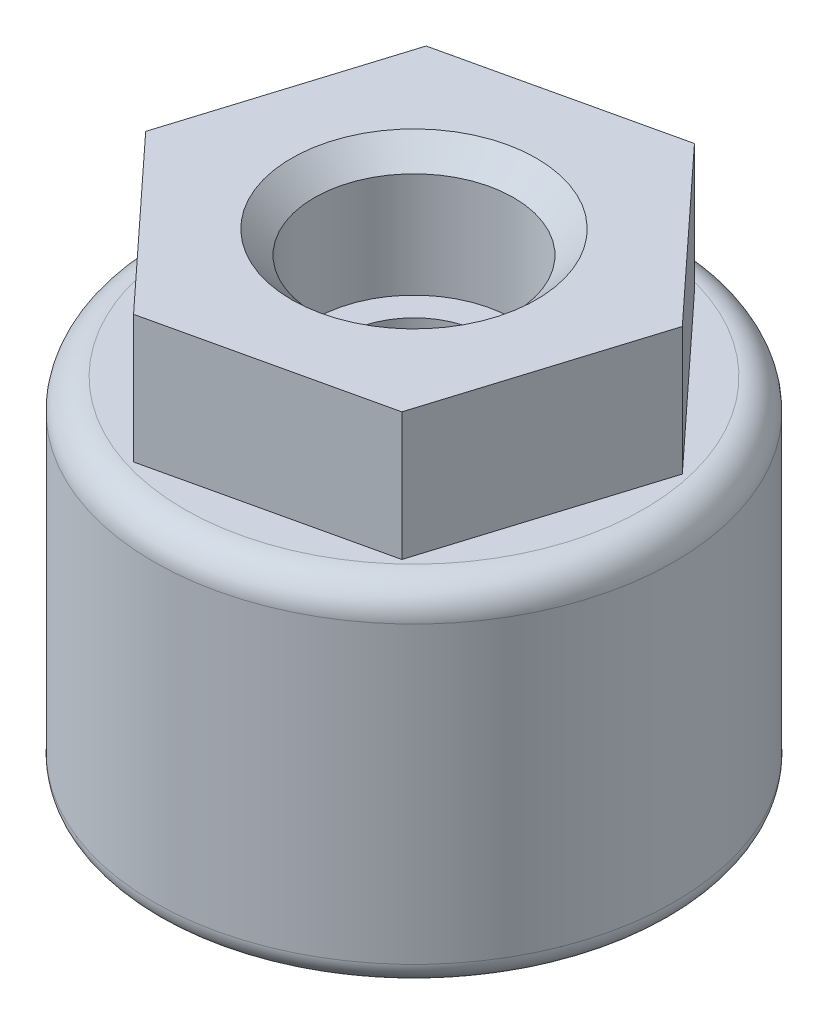
from build123d import *

# Parameters (mm, degrees)
IZIM1_R                     = 14.285
Y_KSEKLIK_EKSTR_ZYON1_DEPTH = 19.1
RADYUS1_R                   = 1.67
RADYUS2_R                   = 1.25
Y_KSEKLIK_EKSTR_ZYON3_DEPTH = 7.02
KES_EKSTR_ZYON1_DEPTH       = 2
KES_EKSTR_ZYON1_DEPTH_BACK  = 29.02
IZIM4_R                     = 3.95
IZIM5_R                     = 5.475
KES_EKSTR_ZYON2_DEPTH       = 7.02
PAH1_SIZE                   = 1.25


with BuildPart() as part:
    # Çizim1 → Yükseklik-Ekstrüzyon1 (new body)
    with BuildSketch(Plane(origin=(0, 0, 0), x_dir=(1, 0, 0), z_dir=(0, 1, 0))):
        with Locations(Location((0, 0, 0), (0, 0, 270))):
            Circle(IZIM1_R)
    extrude(amount=Y_KSEKLIK_EKSTR_ZYON1_DEPTH)

    # Radyus1
    radyus1_edges = [part.edges().sort_by_distance(p)[0] for p in [
        (0, 19.1, -14.285),
    ]]
    fillet(radyus1_edges, radius=RADYUS1_R)

    # Radyus2
    radyus2_edges = [part.edges().sort_by_distance(p)[0] for p in [
        (0, 0, -14.285),
    ]]
    fillet(radyus2_edges, radius=RADYUS2_R)

    # Çizim2 → Yükseklik-Ekstrüzyon3 (add)
    with BuildSketch(Plane(origin=(0, 19.1, 0), x_dir=(1, 0, 0), z_dir=(0, 1, 0))):
        Polygon((8.364308265, -9.030641206), (12.002918829, 2.728382839), (3.638610564, 11.759024045), (-8.364308265, 9.030641206), (-12.002918829, -2.728382839), (-3.638610564, -11.759024045), align=None)
    extrude(amount=Y_KSEKLIK_EKSTR_ZYON3_DEPTH)

    # Çizim4 → Kes-Ekstrüzyon1 (cut, two sides: drawn at the far end of the back side and taken through both)
    with BuildSketch(Plane(origin=(0, 26.12, 0), x_dir=(1, 0, 0), z_dir=(0, 1, 0)).offset(-KES_EKSTR_ZYON1_DEPTH_BACK)):
        with Locations(Location((0, 0, 0), (0, 0, 270))):
            Circle(IZIM4_R)
    extrude(amount=KES_EKSTR_ZYON1_DEPTH + KES_EKSTR_ZYON1_DEPTH_BACK, mode=Mode.SUBTRACT)

    # Çizim5 → Kes-Ekstrüzyon2 (cut)
    with BuildSketch(Plane(origin=(0, 26.12, 0), x_dir=(1, 0, 0), z_dir=(0, 1, 0))):
        with Locations(Location((0, 0, 0), (0, 0, 270))):
            Circle(IZIM5_R)
    extrude(amount=-KES_EKSTR_ZYON2_DEPTH, mode=Mode.SUBTRACT)

    # Pah1
    pah1_edges = [part.edges().sort_by_distance(p)[0] for p in [
        (0, 26.12, -5.475),
    ]]
    chamfer(pah1_edges, length=PAH1_SIZE)


solid = part.part
